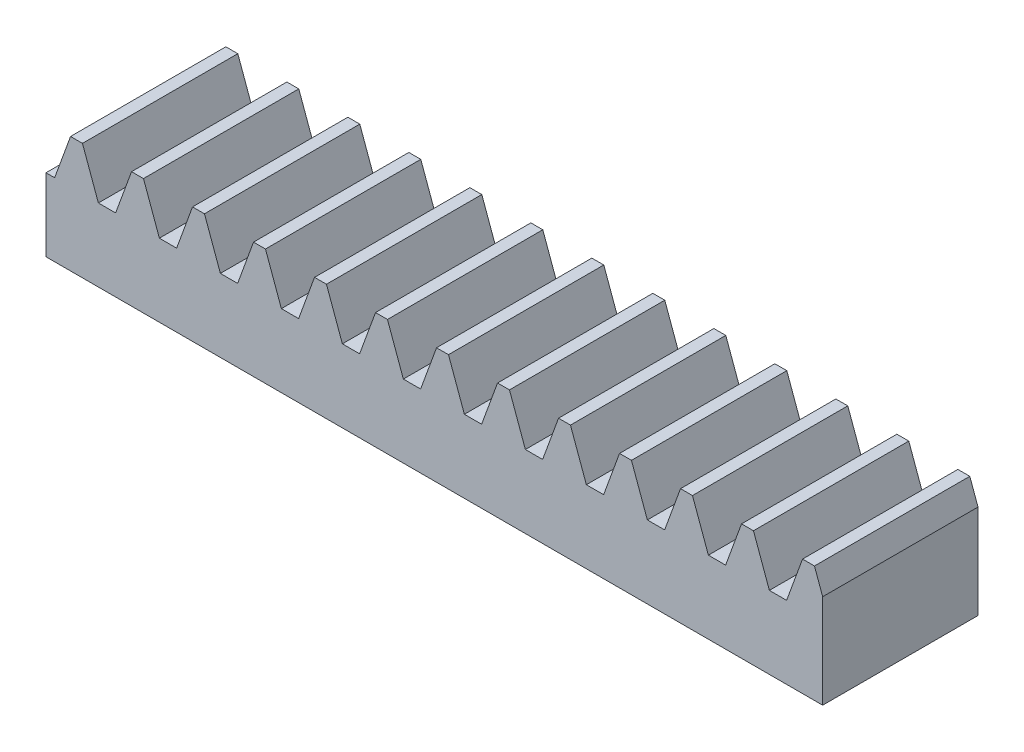
from build123d import *

# Parameters (mm, degrees)
BLANKSKE_W        = 40
BLANKSKE_H        = 6
BLANK_DEPTH       = 8
TOOTHCUTSIM_DEPTH = 42.231056256
TEETHCUTS_COUNT   = 14
TEETHCUTS_PITCH   = 3.14159265


with BuildPart() as part:
    # BlankSke → Blank (new body)
    with BuildSketch(Plane.XY):
        with Locations((20, 3)):
            Rectangle(BLANKSKE_W, BLANKSKE_H)
    extrude(amount=-BLANK_DEPTH)

    # TooCutSkeSim → ToothCutSim (cut, through all)
    with BuildSketch(Plane.XY):
        Polygon((0.44443537, 3.75), (-0.44443537, 3.75), (-1.272613241, 6.0254), (1.272613241, 6.0254), align=None)
    toothcutsim = extrude(amount=-TOOTHCUTSIM_DEPTH, mode=Mode.SUBTRACT)

    # TeethCuts: ToothCutSim ×14
    with Locations(*[(i * TEETHCUTS_PITCH, 0, 0) for i in range(1, TEETHCUTS_COUNT)]):
        add(toothcutsim, mode=Mode.SUBTRACT)


solid = part.part
